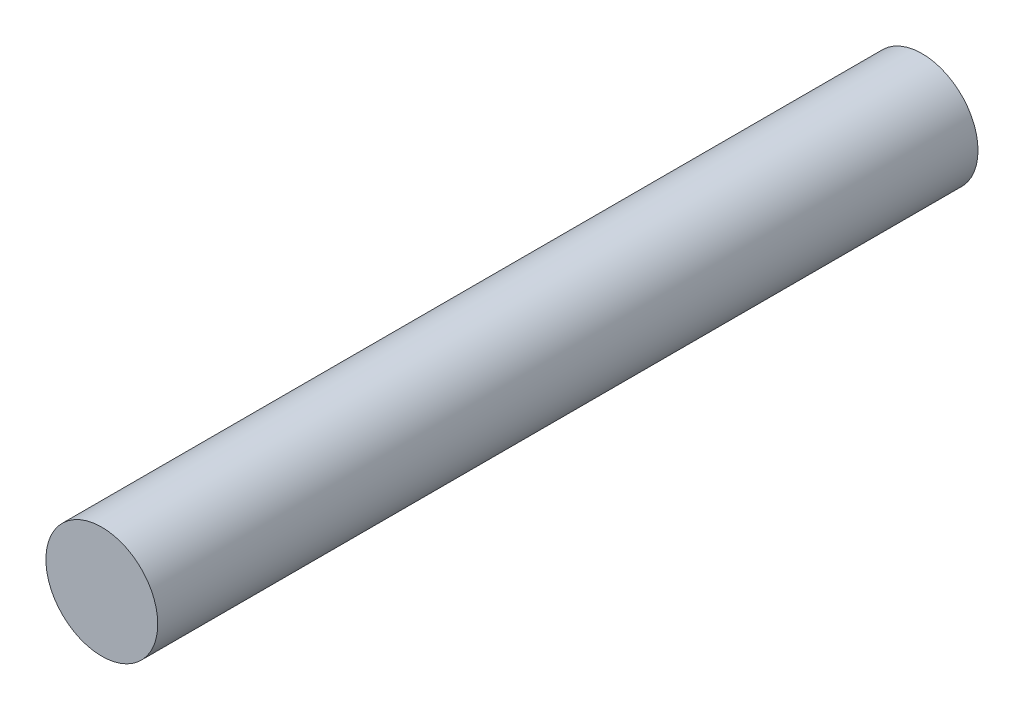
from build123d import *

# Parameters (mm, degrees)
SKETCH1_R           = 1.5
BOSS_EXTRUDE1_DEPTH = 22


with BuildPart() as part:
    # Sketch1 → Boss-Extrude1 (new body)
    with BuildSketch(Plane.XY):
        Circle(SKETCH1_R)
    extrude(amount=BOSS_EXTRUDE1_DEPTH)


solid = part.part
